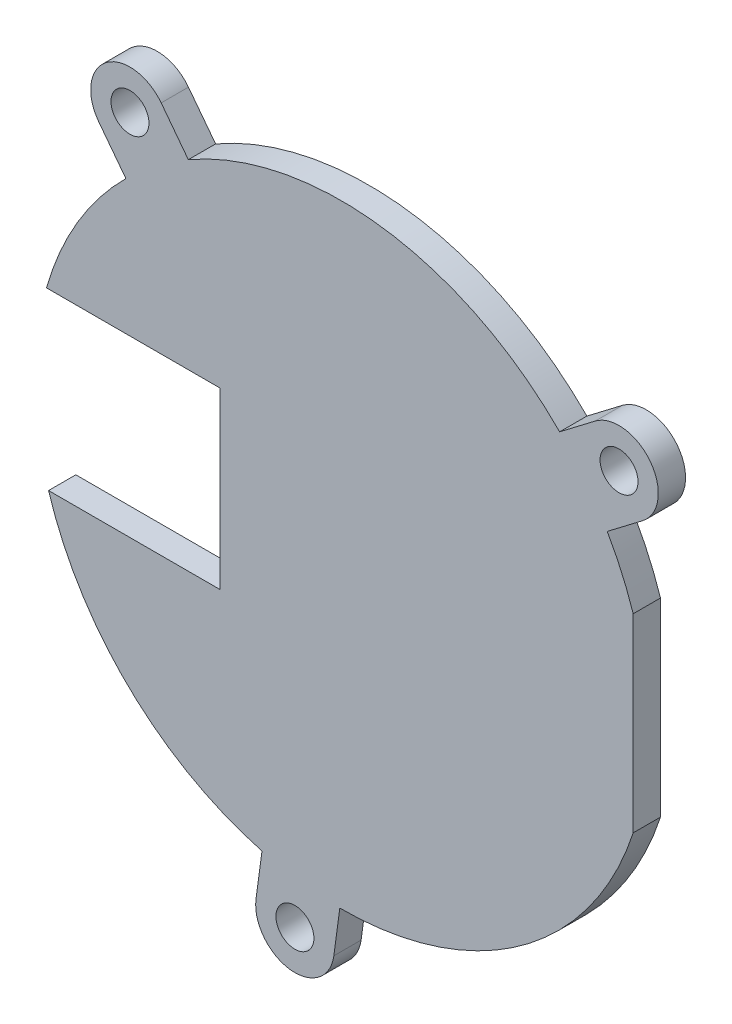
from build123d import *

# Parameters (mm, degrees)
SKETCH1_R           = 1.1049
BOSS_EXTRUDE1_DEPTH = 1.5875


with BuildPart() as part:
    # Sketch1 → Boss-Extrude1 (new body)
    with BuildSketch(Plane.XY):
        with BuildLine():
            Line((-7.084965338, 4.8768), (-17.181244816, 4.8768))
            ThreePointArc((-17.181244816, 4.8768), (-15.375234721, 9.087381854), (-12.557442768, 12.699959952))
            Line((-12.557442768, 12.699959952), (-14.138046409, 14.773078207))
            ThreePointArc((-14.138046409, 14.773078207), (-13.706164911, 17.976993058), (-10.502250061, 17.54511156))
            Line((-10.502250061, 17.54511156), (-8.92164642, 15.471993305))
            ThreePointArc((-8.92164642, 15.471993305), (2.385909574, 17.699880993), (12.699959952, 12.557442768))
            Line((12.699959952, 12.557442768), (14.773078207, 14.138046409))
            ThreePointArc((14.773078207, 14.138046409), (17.976993058, 13.706164911), (17.54511156, 10.502250061))
            Line((17.54511156, 10.502250061), (15.471993305, 8.92164642))
            ThreePointArc((15.471993305, 8.92164642), (16.316677959, 7.26253207), (16.984058744, 5.5245))
            Line((16.984058744, 5.5245), (16.984058744, -5.5245))
            ThreePointArc((16.984058744, -5.5245), (10.454687446, -14.480257667), (-0.100774867, -17.859680739))
            Line((-0.100774867, -17.859680739), (-0.449035291, -20.443252268))
            ThreePointArc((-0.449035291, -20.443252268), (-3.019931544, -22.40337585), (-4.980055125, -19.832479597))
            Line((-4.980055125, -19.832479597), (-4.631794702, -17.248908067))
            ThreePointArc((-4.631794702, -17.248908067), (-12.386896286, -12.866357374), (-17.060660873, -5.2832))
            Line((-17.060660873, -5.2832), (-7.084965338, -5.2832))
            Line((-7.084965338, -5.2832), (-7.084965338, 4.8768))
        make_face()
        with Locations((-2.714545208, -20.137865932)):
            Circle(SKETCH1_R, mode=Mode.SUBTRACT)
        with Locations((-12.320148235, 16.159094884)):
            Circle(SKETCH1_R, mode=Mode.SUBTRACT)
        with Locations((16.159094884, 12.320148235)):
            Circle(SKETCH1_R, mode=Mode.SUBTRACT)
    extrude(amount=BOSS_EXTRUDE1_DEPTH)


solid = part.part
